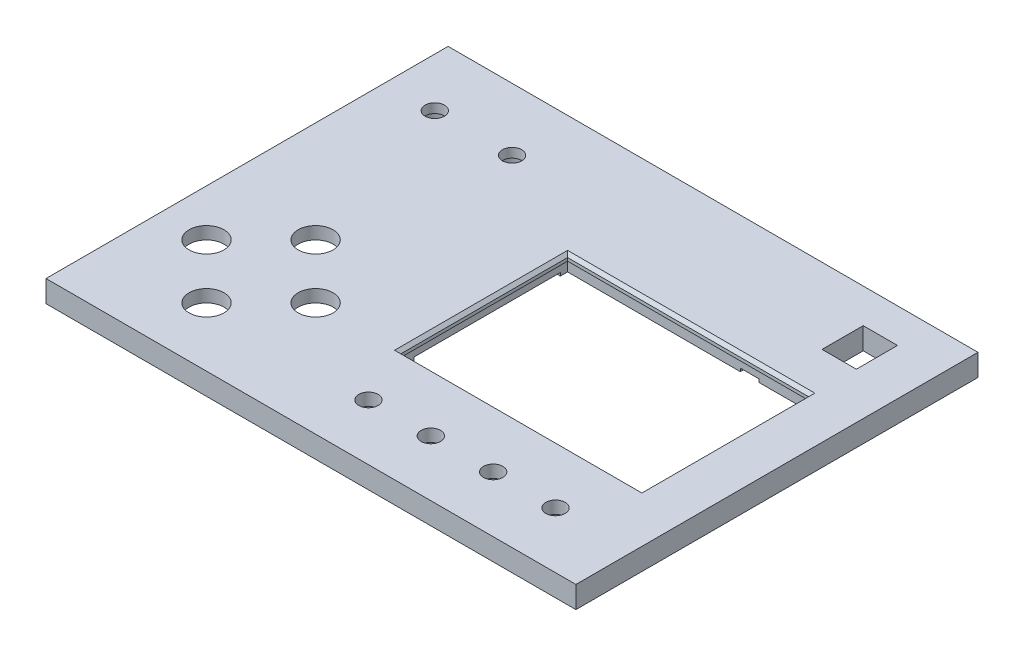
from build123d import *

# Parameters (mm, degrees)
SKETCH1_W           = 105
SKETCH1_H           = 69
BOSS_EXTRUDE1_DEPTH = 5
SKETCH2_W           = 86.836
SKETCH2_H           = 57.499
CUT_EXTRUDE1_DEPTH  = 81.210380614
CUT_EXTRUDE2_DEPTH  = 1
SKETCH4_W           = 5
SKETCH4_H           = 2.165
SKETCH4_H_2         = 0.335
CUT_EXTRUDE3_DEPTH  = 1
CUT_EXTRUDE4_DEPTH  = 81.210380614
SKETCH9_R           = 1
CUT_EXTRUDE7_DEPTH  = 4
SKETCH7_W           = 105
SKETCH7_H           = 30
BOSS_EXTRUDE2_DEPTH = 5
SKETCH8_W           = 11
SKETCH8_H           = 13.2
CUT_EXTRUDE6_DEPTH  = 84.315664794
SKETCH10_W          = 105
SKETCH10_H          = 99
SKETCH10_W_2        = 11
SKETCH10_H_2        = 13.2
SKETCH10_H_3        = 30
BOSS_EXTRUDE3_DEPTH = 2
SKETCH11_W          = 77.336
SKETCH11_H          = 53.499
BOSS_EXTRUDE4_DEPTH = 2
CHAMFER1_SIZE       = 1
SKETCH12_W          = 65
SKETCH12_H          = 129
SKETCH12_R          = 5.6
BOSS_EXTRUDE5_DEPTH = 7
CUT_EXTRUDE8_DEPTH  = 135.221831309
CUT_EXTRUDE9_START  = -3
SKETCH16_R          = 5.5
SKETCH16_R_2        = 3.1
CUT_EXTRUDE9_DEPTH  = 3
SKETCH18_R          = 10
CUT_EXTRUDE10_DEPTH = 3
CHAMFER2_SIZE       = 1
SKETCH19_W          = 17.7
SKETCH19_H          = 13.5
CUT_EXTRUDE11_DEPTH = 2
SKETCH20_W          = 17.7
SKETCH20_H          = 3.413443427
SKETCH20_H_2        = 4.222497079
CUT_EXTRUDE12_DEPTH = 1
SKETCH22_W          = 35.5
SKETCH22_H          = 10
SKETCH22_R          = 1
CUT_EXTRUDE13_DEPTH = 2
SKETCH23_R          = 1
CUT_EXTRUDE14_DEPTH = 4
CUT_EXTRUDE15_DEPTH = 1
SKETCH25_R          = 3.1
CUT_EXTRUDE16_DEPTH = 135.221831309
SKETCH26_R          = 5.15
CUT_EXTRUDE17_DEPTH = 4


with BuildPart() as part:
    # Sketch1 → Boss-Extrude1 (new body)
    with BuildSketch(Plane(origin=(0, 0, 0), x_dir=(1, 0, 0), z_dir=(0, 1, 0))):
        Rectangle(SKETCH1_W, SKETCH1_H)
    extrude(amount=BOSS_EXTRUDE1_DEPTH)

    # Sketch2 → Cut-Extrude1 (cut, through all)
    with BuildSketch(Plane(origin=(17.072113262, 0, 5.103361153), x_dir=(-1, 0, 0), z_dir=(0, -1, 0))):
        with Locations((16.310113262, 4.341361153)):
            Rectangle(SKETCH2_W, SKETCH2_H)
    extrude(amount=-CUT_EXTRUDE1_DEPTH, mode=Mode.SUBTRACT)

    # Sketch3 → Cut-Extrude2 (cut)
    with BuildSketch(Plane(origin=(17.072113262, 0, 5.103361153), x_dir=(-1, 0, 0), z_dir=(0, -1, 0))):
        Polygon((59.822113262, 30.765861153), (54.524773562, 30.765861153), (54.524773562, -16.234138847), (59.822113262, -16.234138847), (65.822113262, -16.234138847), (65.822113262, 30.765861153), align=None)
    extrude(amount=-CUT_EXTRUDE2_DEPTH, mode=Mode.SUBTRACT)

    # Sketch4 → Cut-Extrude3 (cut)
    with BuildSketch(Plane(origin=(17.072113262, 0, 5.103361153), x_dir=(-1, 0, 0), z_dir=(0, -1, 0))):
        Polygon((-1.187888405, 35.255861153), (3.812111595, 35.255861153), (3.812111595, 33.090861153), (4.312111595, 33.090861153), (4.312111595, 35.755861153), (-1.687888405, 35.755861153), (-1.687888405, 33.090861153), (-1.187888405, 33.090861153), align=None)
        with Locations((1.312111595, 34.173361153)):
            Rectangle(SKETCH4_W, SKETCH4_H)
        Polygon((4.312111595, 33.090861153), (3.812111595, 33.090861153), (3.812111595, 32.755861153), (-1.187888405, 32.755861153), (-1.187888405, 33.090861153), (-1.687888405, 33.090861153), (-1.687888405, 32.255861153), (4.312111595, 32.255861153), align=None)
        with Locations((1.312111595, 32.923361153)):
            Rectangle(SKETCH4_W, SKETCH4_H_2)
    extrude(amount=-CUT_EXTRUDE3_DEPTH, mode=Mode.SUBTRACT)

    # Sketch5 → Cut-Extrude4 (cut, through all)
    with BuildSketch(Plane(origin=(17.072113262, 0, 5.103361153), x_dir=(-1, 0, 0), z_dir=(0, -1, 0))):
        with BuildLine():
            Line((-31.677886738, -0.896638847), (-31.677886738, 11.103361153))
            ThreePointArc((-31.677886738, 11.103361153), (-31.220399504, 12.207833039), (-30.115927617, 12.665320274))
            Line((-30.115927617, 12.665320274), (-28.350143546, 12.665320274))
            ThreePointArc((-28.350143546, 12.665320274), (-27.521232808, 13.008666344), (-27.177886738, 13.837577082))
            Line((-27.177886738, 13.837577082), (-18.865935491, 13.837577082))
            Line((-18.865935491, 13.837577082), (-18.865935491, -4.56597095))
            Line((-18.865935491, -4.56597095), (-27.177886738, -4.56597095))
            ThreePointArc((-27.177886738, -4.56597095), (-27.60841615, -3.526581006), (-28.647806094, -3.096051594))
            Line((-28.647806094, -3.096051594), (-29.478473991, -3.096051594))
            ThreePointArc((-29.478473991, -3.096051594), (-31.033693659, -2.451858515), (-31.677886738, -0.896638847))
        make_face()
    extrude(amount=-CUT_EXTRUDE4_DEPTH, mode=Mode.SUBTRACT)

    # Sketch9 → Cut-Extrude7 (cut)
    with BuildSketch(Plane(origin=(17.072113262, 0, 5.103361153), x_dir=(-1, 0, 0), z_dir=(0, -1, 0))):
        with Locations(Location((-28.677886738, 33.103361153, 0), (0, 0, 90))):
            Circle(SKETCH9_R)
        with Locations(Location((62.822113262, 33.103361153, 0), (0, 0, 90))):
            Circle(SKETCH9_R)
        with Locations(Location((-28.677886738, -22.896638847, 0), (0, 0, 90))):
            Circle(SKETCH9_R)
        with Locations(Location((62.822113262, -22.896638847, 0), (0, 0, 90))):
            Circle(SKETCH9_R)
    extrude(amount=-CUT_EXTRUDE7_DEPTH, mode=Mode.SUBTRACT)

    # Sketch7 → Boss-Extrude2 (add)
    with BuildSketch(Plane(origin=(0, 5, 0), x_dir=(1, 0, 0), z_dir=(0, 1, 0))):
        with Locations((0, 49.5)):
            Rectangle(SKETCH7_W, SKETCH7_H)
        with Locations((0, -49.5)):
            Rectangle(SKETCH7_W, SKETCH7_H)
    extrude(amount=-BOSS_EXTRUDE2_DEPTH)

    # Sketch8 → Cut-Extrude6 (cut, through all)
    with BuildSketch(Plane(origin=(0, 5, 0), x_dir=(1, 0, 0), z_dir=(0, 1, 0))):
        with Locations((32.18, 46.886314888)):
            Rectangle(SKETCH8_W, SKETCH8_H)
    extrude(amount=-CUT_EXTRUDE6_DEPTH, mode=Mode.SUBTRACT)

    # Sketch10 → Boss-Extrude3 (add)
    # profile 1 of 2: a face of its own
    with BuildSketch(Plane(origin=(0, 5, 0), x_dir=(1, 0, 0), z_dir=(0, 1, 0))):
        with Locations((0, 15)):
            Rectangle(SKETCH10_W, SKETCH10_H)
        Polygon((-42.656, 27.9875), (44.18, 27.9875), (44.18, 8.734215929), (44.18, -9.669332102), (44.18, -29.5115), (-42.656, -29.5115), align=None, mode=Mode.SUBTRACT)
        with Locations((32.18, 46.886314888)):
            Rectangle(SKETCH10_W_2, SKETCH10_H_2, mode=Mode.SUBTRACT)
    # profile 2 of 2: a face of its own
    with BuildSketch(Plane(origin=(0, 5, 0), x_dir=(1, 0, 0), z_dir=(0, 1, 0))):
        with Locations((0, -49.5)):
            Rectangle(SKETCH10_W, SKETCH10_H_3)
    extrude(amount=BOSS_EXTRUDE3_DEPTH)

    # Sketch11 → Boss-Extrude4 (add)
    with BuildSketch(Plane(origin=(0, 7, 0), x_dir=(1, 0, 0), z_dir=(0, 1, 0))):
        Polygon((-40.656, 27.9875), (-42.656, 27.9875), (-42.656, 25.9875), (-42.656, -27.5115), (-42.656, -29.5115), (-40.656, -29.5115), (36.68, -29.5115), (44.18, -29.5115), (44.18, 27.9875), (36.68, 27.9875), align=None)
        with Locations((-1.988, -0.762)):
            Rectangle(SKETCH11_W, SKETCH11_H, mode=Mode.SUBTRACT)
    extrude(amount=-BOSS_EXTRUDE4_DEPTH)

    # Chamfer1
    chamfer1_edges = [part.edges().sort_by_distance(p)[0] for p in [
        (-40.656, 7, 0.762),
        (-1.988, 7, 27.5115),
        (36.68, 7, 0.762),
        (-1.988, 7, -25.9875),
    ]]
    chamfer(chamfer1_edges, length=CHAMFER1_SIZE)

    # Sketch12 → Boss-Extrude5 (add)
    with BuildSketch(Plane(origin=(0, 7, 0), x_dir=(1, 0, 0), z_dir=(0, 1, 0))):
        with Locations((-85, 0)):
            Rectangle(SKETCH12_W, SKETCH12_H)
        with Locations(Location((-85, -45.5, 0), (0, 0, 270))):
            Circle(SKETCH12_R, mode=Mode.SUBTRACT)
        with Locations(Location((-102.5, -28, 0), (0, 0, 270))):
            Circle(SKETCH12_R, mode=Mode.SUBTRACT)
        with Locations(Location((-67.5, -28, 0), (0, 0, 270))):
            Circle(SKETCH12_R, mode=Mode.SUBTRACT)
        with Locations(Location((-85, -10.5, 0), (0, 0, 270))):
            Circle(SKETCH12_R, mode=Mode.SUBTRACT)
    extrude(amount=-BOSS_EXTRUDE5_DEPTH)

    # Sketch15 → Cut-Extrude8 (cut, through all)
    with BuildSketch(Plane(origin=(0, 7, 0), x_dir=(1, 0, 0), z_dir=(0, 1, 0))):
        with BuildLine():
            ThreePointArc((-28.941, -46.50575), (-32.041, -43.40575), (-35.141, -46.50575))
            Line((-35.141, -46.50575), (-28.941, -46.50575))
        make_face()
        with BuildLine():
            Line((-28.941, -46.50575), (-35.141, -46.50575))
            ThreePointArc((-35.141, -46.50575), (-32.041, -49.60575), (-28.941, -46.50575))
        make_face()
        with BuildLine():
            ThreePointArc((-8.941, -46.50575), (-12.041, -43.40575), (-15.141, -46.50575))
            Line((-15.141, -46.50575), (-8.941, -46.50575))
        make_face()
        with BuildLine():
            Line((-8.941, -46.50575), (-15.141, -46.50575))
            ThreePointArc((-15.141, -46.50575), (-12.041, -49.60575), (-8.941, -46.50575))
        make_face()
        with BuildLine():
            ThreePointArc((4.859, -46.50575), (7.959, -49.60575), (11.059, -46.50575))
            Line((11.059, -46.50575), (4.859, -46.50575))
        make_face()
        with BuildLine():
            Line((4.859, -46.50575), (11.059, -46.50575))
            ThreePointArc((11.059, -46.50575), (7.959, -43.40575), (4.859, -46.50575))
        make_face()
        with BuildLine():
            ThreePointArc((24.859, -46.50575), (27.959, -49.60575), (31.059, -46.50575))
            Line((31.059, -46.50575), (24.859, -46.50575))
        make_face()
        with BuildLine():
            Line((24.859, -46.50575), (31.059, -46.50575))
            ThreePointArc((31.059, -46.50575), (27.959, -43.40575), (24.859, -46.50575))
        make_face()
    extrude(amount=-CUT_EXTRUDE8_DEPTH, mode=Mode.SUBTRACT)

    # Sketch16 → Cut-Extrude9 (cut)
    # profile 1 of 4: a face of its own
    with BuildSketch(Plane.XZ.offset(CUT_EXTRUDE9_START)):
        with Locations(Location((-32.041, 46.50575, 0), (0, 0, 270))):
            Circle(SKETCH16_R)
        with Locations(Location((-32.041, 46.50575, 0), (0, 0, 90))):
            Circle(SKETCH16_R_2, mode=Mode.SUBTRACT)
    # profile 2 of 4: a face of its own
    with BuildSketch(Plane.XZ.offset(CUT_EXTRUDE9_START)):
        with Locations(Location((-12.041, 46.50575, 0), (0, 0, 270))):
            Circle(SKETCH16_R)
        with Locations(Location((-12.041, 46.50575, 0), (0, 0, 90))):
            Circle(SKETCH16_R_2, mode=Mode.SUBTRACT)
    # profile 3 of 4: a face of its own
    with BuildSketch(Plane.XZ.offset(CUT_EXTRUDE9_START)):
        with Locations(Location((7.959, 46.50575, 0), (0, 0, 270))):
            Circle(SKETCH16_R)
        with Locations(Location((7.959, 46.50575, 0), (0, 0, 90))):
            Circle(SKETCH16_R_2, mode=Mode.SUBTRACT)
    # profile 4 of 4: a face of its own
    with BuildSketch(Plane.XZ.offset(CUT_EXTRUDE9_START)):
        with Locations(Location((27.959, 46.50575, 0), (0, 0, 270))):
            Circle(SKETCH16_R)
        with Locations(Location((27.959, 46.50575, 0), (0, 0, 90))):
            Circle(SKETCH16_R_2, mode=Mode.SUBTRACT)
    extrude(amount=CUT_EXTRUDE9_DEPTH, mode=Mode.SUBTRACT)

    # Sketch18 → Cut-Extrude10 (cut)
    with BuildSketch(Plane.XZ):
        with Locations(Location((-85, 45.5, 0), (0, 0, 270))):
            Circle(SKETCH18_R)
        with Locations(Location((-102.5, 28, 0), (0, 0, 270))):
            Circle(SKETCH18_R)
        with Locations(Location((-85, 10.5, 0), (0, 0, 270))):
            Circle(SKETCH18_R)
        with Locations(Location((-67.5, 28, 0), (0, 0, 270))):
            Circle(SKETCH18_R)
    extrude(amount=-CUT_EXTRUDE10_DEPTH, mode=Mode.SUBTRACT)

    # Chamfer2
    chamfer2_edges = [part.edges().sort_by_distance(p)[0] for p in [
        (-85, 0, 20.5),
        (-102.5, 0, 38),
        (-67.5, 0, 38),
        (-85, 0, 55.5),
    ]]
    chamfer(chamfer2_edges, length=CHAMFER2_SIZE)

    # Sketch19 → Cut-Extrude11 (cut)
    with BuildSketch(Plane.XZ):
        with Locations((9.346, -57.75)):
            Rectangle(SKETCH19_W, SKETCH19_H)
    extrude(amount=-CUT_EXTRUDE11_DEPTH, mode=Mode.SUBTRACT)

    # Sketch20 → Cut-Extrude12 (cut)
    with BuildSketch(Plane.XZ.offset(-2)):
        with Locations((9.346, -62.793278286)):
            Rectangle(SKETCH20_W, SKETCH20_H)
        with Locations((9.346, -53.111248539)):
            Rectangle(SKETCH20_W, SKETCH20_H_2)
    extrude(amount=-CUT_EXTRUDE12_DEPTH, mode=Mode.SUBTRACT)

    # Sketch22 → Cut-Extrude13 (cut)
    with BuildSketch(Plane.XZ):
        with Locations((-42.589089221, -59.5)):
            Rectangle(SKETCH22_W, SKETCH22_H)
        with Locations(Location((-57.839089221, -59.5, 0), (0, 0, 270))):
            Circle(SKETCH22_R, mode=Mode.SUBTRACT)
    extrude(amount=-CUT_EXTRUDE13_DEPTH, mode=Mode.SUBTRACT)

    # Sketch23 → Cut-Extrude14 (cut)
    with BuildSketch(Plane.XZ):
        with Locations(Location((-57.839089221, -59.5, 0), (0, 0, 270))):
            Circle(SKETCH23_R)
    extrude(amount=-CUT_EXTRUDE14_DEPTH, mode=Mode.SUBTRACT)

    # Sketch24 → Cut-Extrude15 (cut)
    with BuildSketch(Plane.XZ.offset(-2)):
        with BuildLine():
            Line((-35.839089221, -62.003634145), (-25.839089221, -62.003634145))
            ThreePointArc((-25.839089221, -62.003634145), (-24.842723365, -63), (-25.839089221, -63.996365855))
            Line((-25.839089221, -63.996365855), (-35.839089221, -63.996365855))
            ThreePointArc((-35.839089221, -63.996365855), (-36.835455076, -63), (-35.839089221, -62.003634145))
        make_face()
    extrude(amount=-CUT_EXTRUDE15_DEPTH, mode=Mode.SUBTRACT)

    # Sketch25 → Cut-Extrude16 (cut, through all)
    with BuildSketch(Plane(origin=(0, 7, 0), x_dir=(1, 0, 0), z_dir=(0, 1, 0))):
        with Locations(Location((-101.779279968, 44.5, 0), (0, 0, 270))):
            Circle(SKETCH25_R)
        with Locations(Location((-76.986441198, 44.5, 0), (0, 0, 270))):
            Circle(SKETCH25_R)
    extrude(amount=-CUT_EXTRUDE16_DEPTH, mode=Mode.SUBTRACT)

    # Sketch26 → Cut-Extrude17 (cut)
    with BuildSketch(Plane.XZ):
        with Locations(Location((-101.779279968, -44.5, 0), (0, 0, 270))):
            Circle(SKETCH26_R)
        with Locations(Location((-76.986441198, -44.5, 0), (0, 0, 270))):
            Circle(SKETCH26_R)
    extrude(amount=-CUT_EXTRUDE17_DEPTH, mode=Mode.SUBTRACT)


solid = part.part
